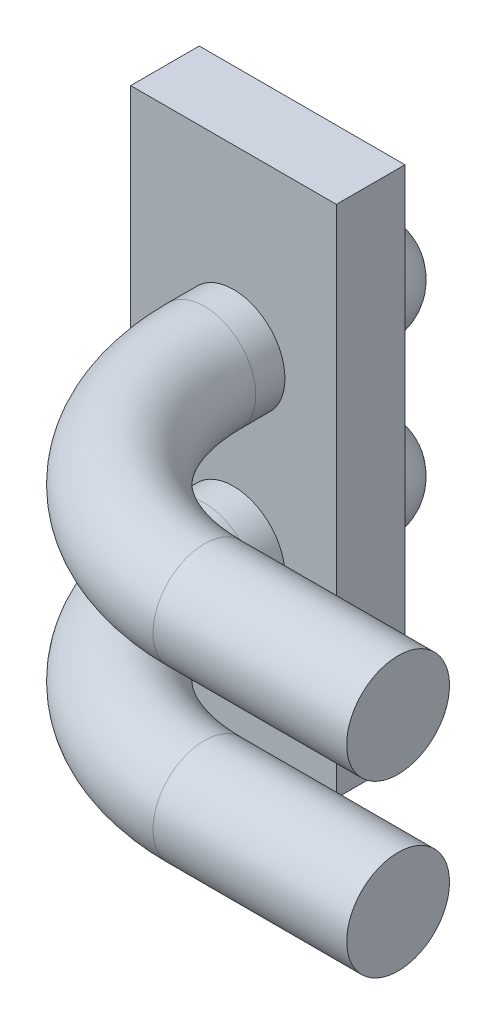
from build123d import *

# Parameters (mm, degrees)
SKETCH1_W           = 6
SKETCH1_H           = 15
BOSS_EXTRUDE1_DEPTH = 2
SKETCH2_R           = 1.5
BOSS_EXTRUDE2_DEPTH = 3
FILLET1_R           = 1.5
SKETCH3_R           = 1.5


with BuildPart() as part:
    # Sketch1 → Boss-Extrude1 (new body)
    with BuildSketch(Plane.XY):
        Rectangle(SKETCH1_W, SKETCH1_H)
    extrude(amount=BOSS_EXTRUDE1_DEPTH)

    # Sketch2 → Boss-Extrude2 (add)
    with BuildSketch(Plane(origin=(0, 0, 0), x_dir=(-1, 0, 0), z_dir=(0, 0, -1))):
        with Locations((0, 2.35)):
            Circle(SKETCH2_R)
        with Locations((0, -2.62)):
            Circle(SKETCH2_R)
    extrude(amount=BOSS_EXTRUDE2_DEPTH)

    # Fillet1
    fillet1_edges = [part.edges().sort_by_distance(p)[0] for p in [
        (1.5, 2.35, -3),
        (1.5, -2.62, -3),
    ]]
    fillet(fillet1_edges, radius=FILLET1_R)

    # Sweep1: sweep along a path in Sketch4
    with BuildLine(Plane(origin=(0, 2.35, 0), x_dir=(-1, 0, 0), z_dir=(0, 1, 0))) as sweep1_path:
        Line((0, 2), (0, 2.85))
        ThreePointArc((0, 2.85), (-1.757359313, 7.092640687), (-6, 8.85))
        Line((-6, 8.85), (-11.65, 8.85))
    # Sketch3 → Sweep1 (sweep)
    with BuildSketch(Plane.XY.offset(2)):
        with Locations((0, -2.62)):
            Circle(SKETCH3_R)
        with Locations((0, 2.35)):
            Circle(SKETCH3_R)
    sweep(path=sweep1_path.line)


solid = part.part
